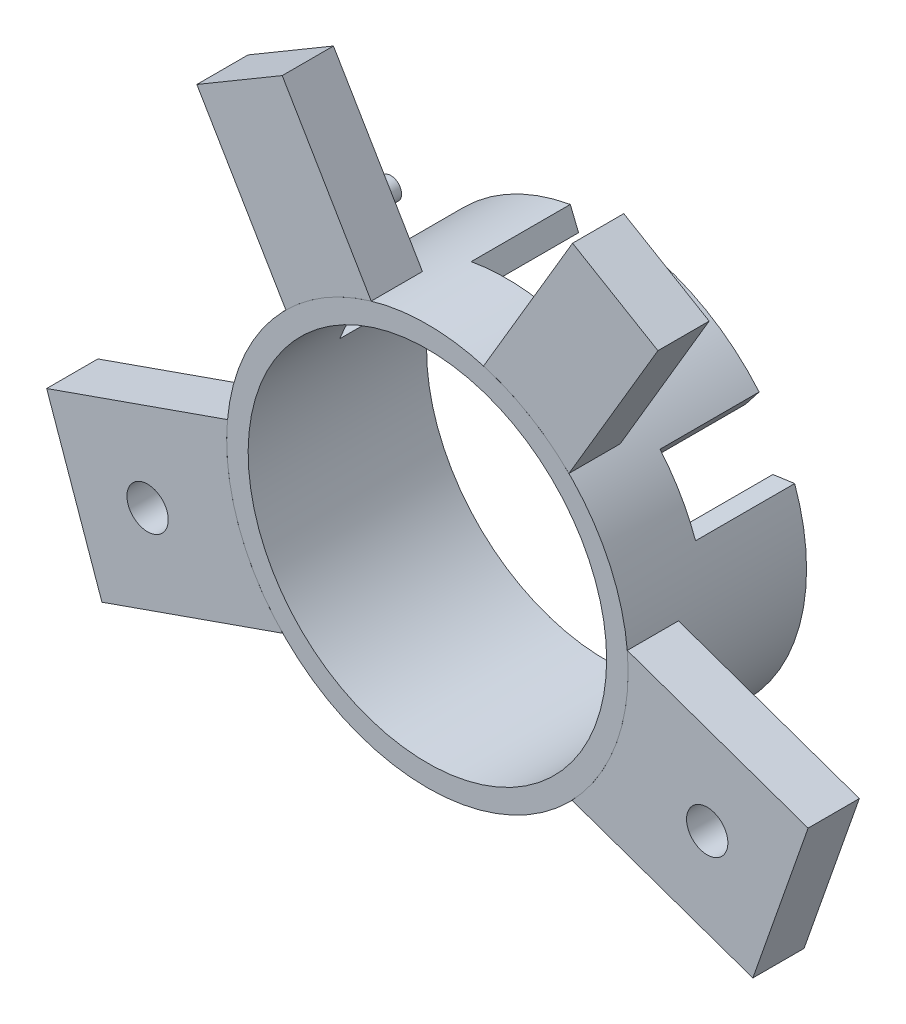
from build123d import *

# Parameters (mm, degrees)
IZIM1_R                       = 12.15
IZIM1_R_2                     = 10.85
Y_KSEKLIK_EKSTR_ZYON2_DEPTH   = 10.8
KES_EKSTR_ZYON1_DEPTH         = 6
Y_KSEKLIK_EKSTR_ZYON3_DEPTH   = 3.1
Y_KSEKLIK_EKSTR_ZYON3_2_DEPTH = 3.1
Y_KSEKLIK_EKSTR_ZYON3_3_DEPTH = 3.1
Y_KSEKLIK_EKSTR_ZYON3_4_DEPTH = 3.1
IZIM4_R                       = 0.65
IZIM4_R_2                     = 2.1
Y_KSEKLIK_EKSTR_ZYON4_DEPTH   = 2.26
IZIM5_R                       = 1.25
KES_EKSTR_ZYON2_DEPTH         = 5.36


with BuildPart() as part:
    # Çizim1 → Yükseklik-Ekstrüzyon2 (new body)
    with BuildSketch(Plane.XY):
        with Locations(Location((0, 0, 0), (0, 0, 180))):
            Circle(IZIM1_R)
        with Locations(Location((0, 0, 0), (0, 0, 180))):
            Circle(IZIM1_R_2, mode=Mode.SUBTRACT)
    extrude(amount=Y_KSEKLIK_EKSTR_ZYON2_DEPTH)

    # Çizim2 → Kes-Ekstrüzyon1 (cut)
    with BuildSketch(Plane.XY):
        with BuildLine():
            Line((1.65, 10.723805295), (2.15, 11.958260743))
            ThreePointArc((2.15, 11.958260743), (0, 12.15), (-2.15, 11.958260743))
            Line((-2.15, 11.958260743), (-1.65, 10.723805295))
            ThreePointArc((-1.65, 10.723805295), (0, 10.85), (1.65, 10.723805295))
        make_face()
        with BuildLine():
            Line((8.462087811, 6.790844564), (9.281157589, 7.84108499))
            ThreePointArc((9.281157589, 7.84108499), (10.522208656, 6.075), (11.431157589, 4.117175753))
            Line((11.431157589, 4.117175753), (10.112087811, 3.932960731))
            ThreePointArc((10.112087811, 3.932960731), (9.396375631, 5.425), (8.462087811, 6.790844564))
        make_face()
        with BuildLine():
            Line((-10.112087811, 3.932960731), (-11.431157589, 4.117175753))
            ThreePointArc((-11.431157589, 4.117175753), (-10.522208656, 6.075), (-9.281157589, 7.84108499))
            Line((-9.281157589, 7.84108499), (-8.462087811, 6.790844564))
            ThreePointArc((-8.462087811, 6.790844564), (-9.396375631, 5.425), (-10.112087811, 3.932960731))
        make_face()
    extrude(amount=KES_EKSTR_ZYON1_DEPTH, mode=Mode.SUBTRACT)


with BuildPart() as body_2:
    # Çizim3 → Yükseklik-Ekstrüzyon3 (new body)
    with BuildSketch(Plane.XY.offset(10.8)):
        with BuildLine():
            Line((3.4, 11.664583147), (8.787130691, 20.793593111))
            Line((8.787130691, 20.793593111), (13.954494822, 17.744273851))
            Line((13.954494822, 17.744273851), (8.56736413, 8.615263888))
            ThreePointArc((8.56736413, 8.615263888), (6.1748715, 10.463912364), (3.4, 11.664583147))
        make_face()
    extrude(amount=-Y_KSEKLIK_EKSTR_ZYON3_DEPTH)



with BuildPart() as body_3:
    # Çizim3 → Y_kseklik-Ekstr_zyon3 2 (new body)
    with BuildSketch(Plane.XY.offset(10.8)):
        with BuildLine():
            Line((-8.56736413, 8.615263888), (-13.954494822, 17.744273851))
            Line((-13.954494822, 17.744273851), (-8.787130691, 20.793593111))
            Line((-8.787130691, 20.793593111), (-3.4, 11.664583147))
            ThreePointArc((-3.4, 11.664583147), (-6.1748715, 10.463912364), (-8.56736413, 8.615263888))
        make_face()
    extrude(amount=-Y_KSEKLIK_EKSTR_ZYON3_2_DEPTH)


with BuildPart() as body_4:
    # Çizim3 → Y_kseklik-Ekstr_zyon3 3 (new body)
    with BuildSketch(Plane.XY.offset(10.8)):
        with BuildLine():
            Line((8.754164309, -8.425384695), (19.699299537, -12.267781713))
            Line((19.699299537, -12.267781713), (23.044834871, -2.737965695))
            Line((23.044834871, -2.737965695), (12.099699643, 1.104431323))
            ThreePointArc((12.099699643, 1.104431323), (11.464085605, -4.024579635), (8.754164309, -8.425384695))
        make_face()
    extrude(amount=-Y_KSEKLIK_EKSTR_ZYON3_3_DEPTH)


with BuildPart() as body_5:
    # Çizim3 → Y_kseklik-Ekstr_zyon3 4 (new body)
    with BuildSketch(Plane.XY.offset(10.8)):
        with BuildLine():
            Line((-12.099699643, 1.104431323), (-23.044834871, -2.737965695))
            Line((-23.044834871, -2.737965695), (-19.699299537, -12.267781713))
            Line((-19.699299537, -12.267781713), (-8.754164309, -8.425384695))
            ThreePointArc((-8.754164309, -8.425384695), (-11.464085605, -4.024579635), (-12.099699643, 1.104431323))
        make_face()
    extrude(amount=-Y_KSEKLIK_EKSTR_ZYON3_4_DEPTH)


with BuildPart() as body_2_1:
    add(body_2.part)

    add(body_3.part)  # Yükseklik-Ekstrüzyon4 merges body 3

    add(body_4.part)  # Yükseklik-Ekstrüzyon4 merges body 4

    add(body_5.part)  # Yükseklik-Ekstrüzyon4 merges body 5
    # Çizim4 → Yükseklik-Ekstrüzyon4 (add)
    with BuildSketch(Plane(origin=(0, 0, 7.7), x_dir=(-1, 0, 0), z_dir=(0, 0, -1))):
        with Locations(Location((7.572476161, 12.83228759, 0), (0, 0, 180))):
            Circle(IZIM4_R)
        with Locations(Location((-7.572476161, 12.83228759, 0), (0, 0, 180))):
            Circle(IZIM4_R)
        with Locations((16.937400344, -5.946040429)):
            Circle(IZIM4_R_2)
        with Locations((-16.937400344, -5.946040429)):
            Circle(IZIM4_R_2)
    extrude(amount=Y_KSEKLIK_EKSTR_ZYON4_DEPTH)

    # Çizim5 → Kes-Ekstrüzyon2 (cut)
    with BuildSketch(Plane(origin=(0, 0, 5.44), x_dir=(-1, 0, 0), z_dir=(0, 0, -1))):
        with Locations((16.937400344, -5.946040429)):
            Circle(IZIM5_R)
        with Locations((-16.937400344, -5.946040429)):
            Circle(IZIM5_R)
    extrude(amount=-KES_EKSTR_ZYON2_DEPTH, mode=Mode.SUBTRACT)


solid = Compound([part.part, body_2_1.part])
